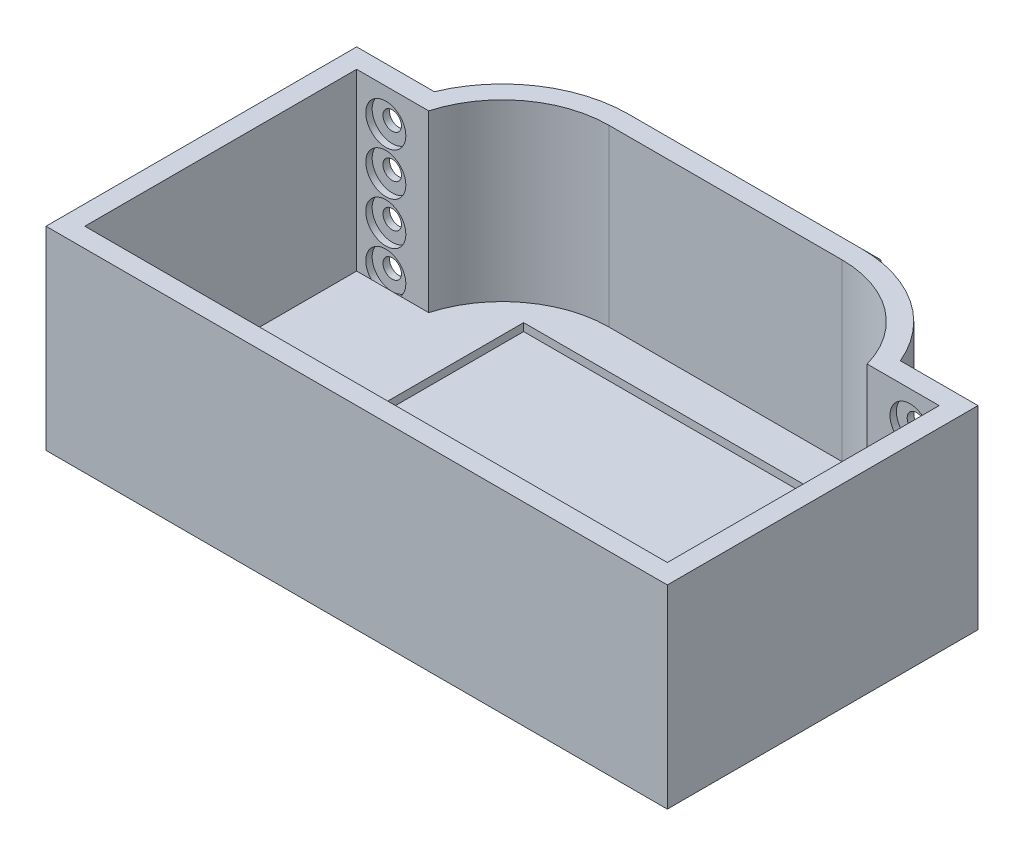
from build123d import *

# Parameters (mm, degrees)
BOSS_EXTRUDE1_DEPTH     = 50
SHELL1_T                = -5
SKETCH2_W               = 84
SKETCH2_H               = 65
CUT_EXTRUDE1_DEPTH      = 2
BOSS_EXTRUDE2_DEPTH     = 45
CHAMFER1_SIZE           = 20
HOLE1_D                 = 4.25
HOLE1_CBORE_D           = 10.25
HOLE1_CBORE_DEPTH       = 40
SKETCH9_R               = 5.159375
CUT_EXTRUDE2_DEPTH      = 1.6491
SKETCH11_R              = 2.38125
CUT_EXTRUDE3_DEPTH      = 5
MIRROR2_COPY_1_SKETCH_R = 5.159375
MIRROR2_COPY_1_DEPTH    = 1.6491


with BuildPart() as part:
    # Sketch1 → Boss-Extrude1 (new body)
    with BuildSketch(Plane(origin=(0, 0, 0), x_dir=(1, 0, 0), z_dir=(0, 1, 0))):
        with BuildLine():
            Line((0, 0), (160, 0))
            Line((160, 0), (160, 80))
            Line((160, 80), (140, 80))
            ThreePointArc((140, 80), (128.027756377, 94.541634566), (110, 100))
            Line((110, 100), (100, 100))
            Line((100, 100), (95, 120))
            Line((95, 120), (65, 120))
            Line((65, 120), (60, 100))
            Line((60, 100), (50, 100))
            ThreePointArc((50, 100), (31.972243623, 94.541634566), (20, 80))
            Line((20, 80), (0, 80))
            Line((0, 80), (0, 0))
        make_face()
    extrude(amount=BOSS_EXTRUDE1_DEPTH)

    # Shell1
    shell1_openings = [part.faces().sort_by_distance(p)[0] for p in [
        (80, 50, -49.668654168),
    ]]
    offset(amount=SHELL1_T, openings=shell1_openings, kind=Kind.INTERSECTION)

    # Sketch2 → Cut-Extrude1 (cut)
    with BuildSketch(Plane(origin=(0, 5, 0), x_dir=(1, 0, 0), z_dir=(0, 1, 0))):
        with Locations((80, 52.5)):
            Rectangle(SKETCH2_W, SKETCH2_H)
    extrude(amount=-CUT_EXTRUDE1_DEPTH, mode=Mode.SUBTRACT)

    # Sketch3 → Boss-Extrude2 (add)
    with BuildSketch(Plane(origin=(0, 5, 0), x_dir=(1, 0, 0), z_dir=(0, 1, 0))):
        Polygon((65, 120), (60, 100), (60, 95), (100, 95), (100, 100), (95, 120), align=None)
    extrude(amount=BOSS_EXTRUDE2_DEPTH)

    # Chamfer1
    chamfer1_edges = [part.edges().sort_by_distance(p)[0] for p in [
        (80, 50, -120),
    ]]
    chamfer(chamfer1_edges, length=CHAMFER1_SIZE)

    # Hole1 (through all)
    with Locations(Plane(origin=(72.5, 50, -110), x_dir=(0, 0, 1), z_dir=(0, 1, 0))):
        with Locations((0, 0), (0, 15)):
            CounterBoreHole(HOLE1_D / 2, HOLE1_CBORE_D / 2, HOLE1_CBORE_DEPTH)

    # Sketch9 → Cut-Extrude2 (cut)
    with BuildSketch(Plane(origin=(0, 0, -80), x_dir=(-1, 0, 0), z_dir=(0, 0, -1))):
        with Locations((-147.5, 41.5)):
            Circle(SKETCH9_R)
        with Locations((-147.5, 30.5)):
            Circle(SKETCH9_R)
        with Locations((-147.5, 19.5)):
            Circle(SKETCH9_R)
        with Locations((-147.5, 8.5)):
            Circle(SKETCH9_R)
    cut_extrude2 = extrude(amount=-CUT_EXTRUDE2_DEPTH, mode=Mode.SUBTRACT)

    # Mirror1: Cut-Extrude2 across plane
    add(cut_extrude2.mirror(Plane.XY.offset(-77.5)), mode=Mode.SUBTRACT)

    # Sketch11 → Cut-Extrude3 (cut)
    with BuildSketch(Plane(origin=(0, 0, -80), x_dir=(-1, 0, 0), z_dir=(0, 0, -1))):
        with Locations((-147.5, 41.5)):
            Circle(SKETCH11_R)
        with Locations((-147.5, 30.5)):
            Circle(SKETCH11_R)
        with Locations((-147.5, 19.5)):
            Circle(SKETCH11_R)
        with Locations((-147.5, 8.5)):
            Circle(SKETCH11_R)
    cut_extrude3 = extrude(amount=-CUT_EXTRUDE3_DEPTH, mode=Mode.SUBTRACT)

    # Mirror2: Cut-Extrude2, Cut-Extrude3 across plane
    add(cut_extrude2.mirror(Plane(origin=(80, 0, 0), x_dir=(0, 0, 1), z_dir=(1, 0, 0))), mode=Mode.SUBTRACT)
    add(cut_extrude3.mirror(Plane(origin=(80, 0, 0), x_dir=(0, 0, 1), z_dir=(1, 0, 0))), mode=Mode.SUBTRACT)

    # Mirror2 copy 1 sketch → Mirror2 copy 1 (cut)
    with BuildSketch(Plane(origin=(160, 0, -75), x_dir=(1, 0, 0), z_dir=(0, 0, 1))):
        with Locations((-147.5, 41.5)):
            Circle(MIRROR2_COPY_1_SKETCH_R)
        with Locations((-147.5, 30.5)):
            Circle(MIRROR2_COPY_1_SKETCH_R)
        with Locations((-147.5, 19.5)):
            Circle(MIRROR2_COPY_1_SKETCH_R)
        with Locations((-147.5, 8.5)):
            Circle(MIRROR2_COPY_1_SKETCH_R)
    extrude(amount=-MIRROR2_COPY_1_DEPTH, mode=Mode.SUBTRACT)


solid = part.part
